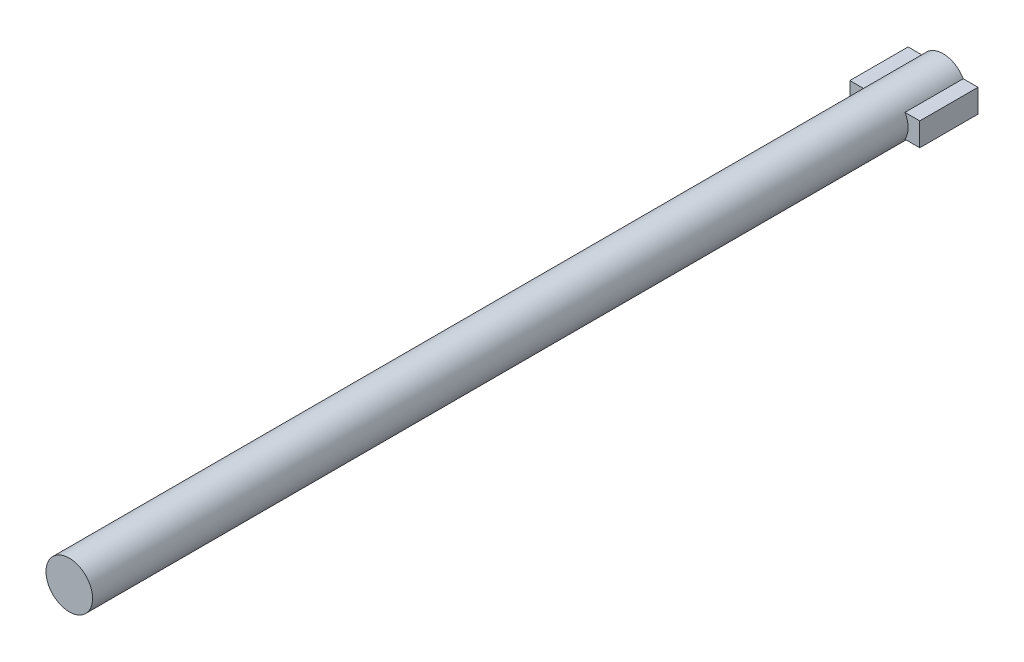
from build123d import *

# Parameters (mm, degrees)
SKETCH_1_R      = 4
EXTRUDE_1_DEPTH = 150
SKETCH_2_W      = 12
SKETCH_2_H      = 4
EXTRUDE_2_DEPTH = 10


with BuildPart() as part:
    # Эскиз1 → Бобышка-Вытянуть1 (new body)
    with BuildSketch(Plane.XY):
        Circle(SKETCH_1_R)
    extrude(amount=EXTRUDE_1_DEPTH)

    # Эскиз2 → Бобышка-Вытянуть2 (add)
    with BuildSketch(Plane(origin=(0, 0, 0), x_dir=(-1, 0, 0), z_dir=(0, 0, -1))):
        Rectangle(SKETCH_2_W, SKETCH_2_H)
    extrude(amount=-EXTRUDE_2_DEPTH)


solid = part.part
